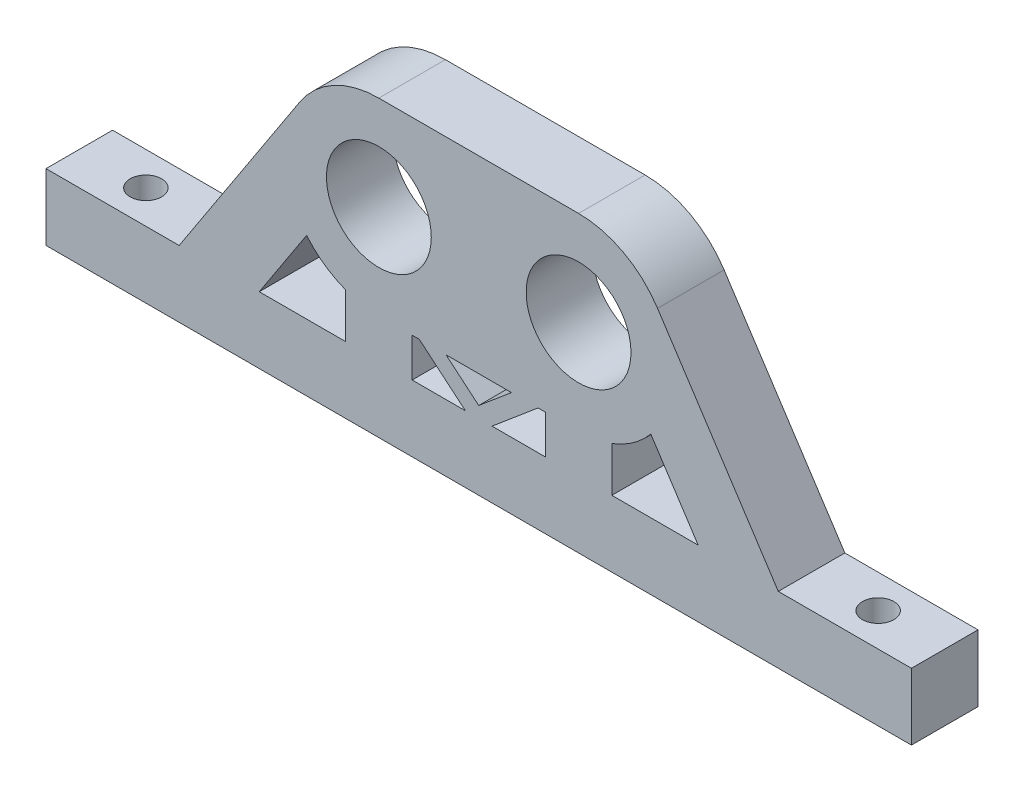
from build123d import *

# Parameters (mm, degrees)
BOSS_EXTRUDE1_DEPTH = 6.35
SKETCH2_R           = 5
CUT_EXTRUDE1_DEPTH  = 55.624765446
SKETCH3_R           = 1.5
CUT_EXTRUDE2_DEPTH  = 56.60442878


with BuildPart() as part:
    # Sketch1 → Boss-Extrude1 (new body)
    with BuildSketch(Plane.XY):
        with BuildLine():
            Line((19.05, 9), (0, 9))
            ThreePointArc((0, 9), (-4.283191939, 7.915444827), (-7.534082106, 4.923170403))
            Line((-7.534082106, 4.923170403), (-19.05, -12.7))
            Line((-19.05, -12.7), (-31.75, -12.7))
            Line((-31.75, -12.7), (-31.75, -19.05))
            Line((-31.75, -19.05), (50.8, -19.05))
            Line((50.8, -19.05), (50.8, -12.7))
            Line((50.8, -12.7), (38.1, -12.7))
            Line((38.1, -12.7), (26.584082106, 4.923170403))
            ThreePointArc((26.584082106, 4.923170403), (23.333191939, 7.915444827), (19.05, 9))
        make_face()
        Polygon((3.862011, -9), (8.255, -12.7), (3.175, -12.7), (3.175, -9), align=None, mode=Mode.SUBTRACT)
        Polygon((12.647989, -9), (9.525, -11.63034105), (6.402011, -9), (9.525, -9), align=None, mode=Mode.SUBTRACT)
        with BuildLine():
            Line((30.458149598, -12.7), (22.225, -12.7))
            Line((22.225, -12.7), (22.225, -8.421364201))
            ThreePointArc((22.225, -8.421364201), (24.252671243, -7.343855386), (25.941688674, -5.788318169))
            Line((25.941688674, -5.788318169), (30.458149598, -12.7))
        make_face(mode=Mode.SUBTRACT)
        Polygon((15.875, -12.7), (10.795, -12.7), (15.187989, -9), (15.875, -9), align=None, mode=Mode.SUBTRACT)
        with BuildLine():
            ThreePointArc((-6.891688674, -5.788318169), (-5.202671243, -7.343855386), (-3.175, -8.421364201))
            Line((-3.175, -8.421364201), (-3.175, -12.7))
            Line((-3.175, -12.7), (-11.408149598, -12.7))
            Line((-11.408149598, -12.7), (-6.891688674, -5.788318169))
        make_face(mode=Mode.SUBTRACT)
    extrude(amount=-BOSS_EXTRUDE1_DEPTH)

    # Sketch2 → Cut-Extrude1 (cut, through all)
    with BuildSketch(Plane.XY):
        Circle(SKETCH2_R)
        with Locations((19.05, 0)):
            Circle(SKETCH2_R)
    extrude(amount=-CUT_EXTRUDE1_DEPTH, mode=Mode.SUBTRACT)

    # Sketch3 → Cut-Extrude2 (cut, through all)
    with BuildSketch(Plane(origin=(0, -12.7, 0), x_dir=(1, 0, 0), z_dir=(0, 1, 0))):
        with Locations(Location((44.45, 3.175, 0), (0, 0, 270))):
            Circle(SKETCH3_R)
        with Locations(Location((-25.4, 3.175, 0), (0, 0, 270))):
            Circle(SKETCH3_R)
    extrude(amount=-CUT_EXTRUDE2_DEPTH, mode=Mode.SUBTRACT)


solid = part.part
